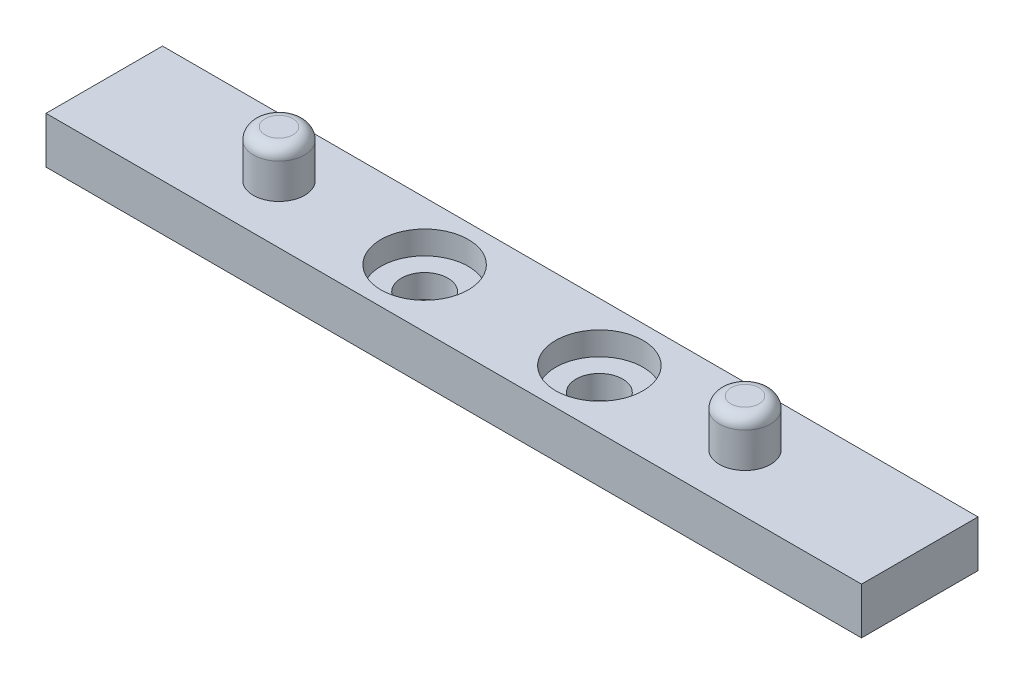
from build123d import *

# Parameters (mm, degrees)
SKETCH1_W           = 88.9
SKETCH1_H           = 12.7
SKETCH1_R           = 2.54
BOSS_EXTRUDE2_DEPTH = 5.08
SKETCH2_R           = 2.794
BOSS_EXTRUDE3_DEPTH = 5.08
FILLET1_R           = 1.27
SKETCH3_R           = 4.7625
CUT_EXTRUDE1_DEPTH  = 2.54


with BuildPart() as part:
    # Sketch1 → Boss-Extrude2 (new body)
    with BuildSketch(Plane(origin=(0, 0, 0), x_dir=(1, 0, 0), z_dir=(0, 1, 0))):
        with Locations((44.45, 6.35)):
            Rectangle(SKETCH1_W, SKETCH1_H)
        with Locations(Location((34.925, 6.35, 0), (0, 0, 270))):
            Circle(SKETCH1_R, mode=Mode.SUBTRACT)
        with Locations(Location((53.975, 6.35, 0), (0, 0, 270))):
            Circle(SKETCH1_R, mode=Mode.SUBTRACT)
    extrude(amount=BOSS_EXTRUDE2_DEPTH)

    # Sketch2 → Boss-Extrude3 (add)
    with BuildSketch(Plane(origin=(0, 5.08, 0), x_dir=(1, 0, 0), z_dir=(0, 1, 0))):
        with Locations(Location((19.05, 6.35, 0), (0, 0, 270))):
            Circle(SKETCH2_R)
        with Locations(Location((69.85, 6.35, 0), (0, 0, 90))):
            Circle(SKETCH2_R)
    extrude(amount=BOSS_EXTRUDE3_DEPTH)

    # Fillet1
    fillet1_edges = [part.edges().sort_by_distance(p)[0] for p in [
        (19.05, 10.16, -9.144),
        (69.85, 10.16, -3.556),
    ]]
    fillet(fillet1_edges, radius=FILLET1_R)

    # Sketch3 → Cut-Extrude1 (cut)
    with BuildSketch(Plane(origin=(0, 5.08, 0), x_dir=(1, 0, 0), z_dir=(0, 1, 0))):
        with Locations(Location((34.925, 6.35, 0), (0, 0, 270))):
            Circle(SKETCH3_R)
        with Locations(Location((53.975, 6.35, 0), (0, 0, 270))):
            Circle(SKETCH3_R)
    extrude(amount=-CUT_EXTRUDE1_DEPTH, mode=Mode.SUBTRACT)


solid = part.part
